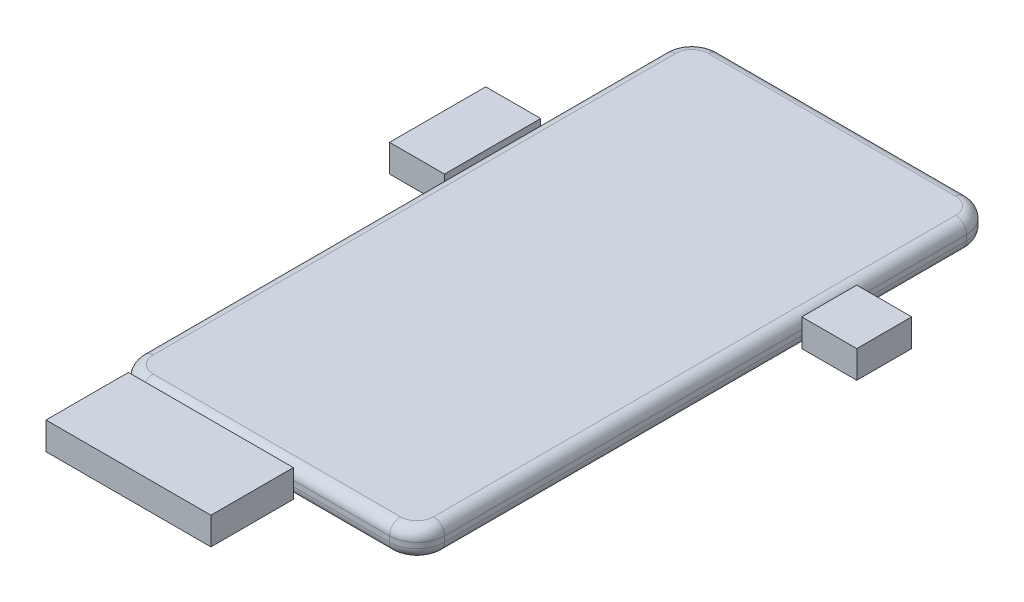
from build123d import *

# Parameters (mm, degrees)
SKETCH1_W           = 69.85
SKETCH1_H           = 133.35
BOSS_EXTRUDE1_DEPTH = 6.35
FILLET2_R           = 6.35
FILLET3_R           = 2.54
SKETCH2_W           = 12.7
SKETCH2_H           = 12.7
BUTTONS_DEPTH       = 6.35
SKETCH2_H_2         = 22.225
BUTTONS_2_DEPTH     = 6.35
SKETCH3_W           = 44.45
SKETCH3_H           = 19.05
CAMERA_DEPTH        = 6.35
SKETCH4_W           = 38.1
SKETCH4_H           = 19.05
USB_DEPTH           = 6.35


with BuildPart() as part:
    # Sketch1 → Boss-Extrude1 (new body)
    with BuildSketch(Plane(origin=(0, 0, 0), x_dir=(1, 0, 0), z_dir=(0, 1, 0))):
        with Locations((34.925, 66.675)):
            Rectangle(SKETCH1_W, SKETCH1_H)
    extrude(amount=BOSS_EXTRUDE1_DEPTH)

    # Fillet2
    fillet2_edges = [part.edges().sort_by_distance(p)[0] for p in [
        (0, 3.175, -133.35),
        (69.85, 3.175, -133.35),
        (69.85, 3.175, 0),
        (0, 3.175, 0),
    ]]
    fillet(fillet2_edges, radius=FILLET2_R)

    # Fillet3
    fillet3_edges = [part.edges().sort_by_distance(p)[0] for p in [
        (0, 0, -66.675),
        (0, 6.35, -66.675),
        (34.925, 0, -133.35),
        (69.85, 0, -66.675),
        (34.925, 0, 0),
        (67.990128061, 0, -1.859871939),
        (1.859871939, 0, -1.859871939),
        (67.990128061, 0, -131.490128061),
        (1.859871939, 0, -131.490128061),
        (34.925, 6.35, -133.35),
        (34.925, 6.35, 0),
        (69.85, 6.35, -66.675),
        (67.990128061, 6.35, -1.859871939),
        (1.859871939, 6.35, -1.859871939),
        (67.990128061, 6.35, -131.490128061),
        (1.859871939, 6.35, -131.490128061),
    ]]
    fillet(fillet3_edges, radius=FILLET3_R)


with BuildPart() as body_2:
    # Sketch2 → buttons (new body)
    with BuildSketch(Plane(origin=(0, 0, 0), x_dir=(1, 0, 0), z_dir=(0, 1, 0))):
        with Locations((76.2, 95.25)):
            Rectangle(SKETCH2_W, SKETCH2_H)
    extrude(amount=BUTTONS_DEPTH)


with BuildPart() as body_3:
    # Sketch2 → buttons 2 (new body)
    with BuildSketch(Plane(origin=(0, 0, 0), x_dir=(1, 0, 0), z_dir=(0, 1, 0))):
        with Locations((-6.35, 87.3125)):
            Rectangle(SKETCH2_W, SKETCH2_H_2)
    extrude(amount=BUTTONS_2_DEPTH)


with BuildPart() as body_4:
    # Sketch3 → camera (new body)
    with BuildSketch(Plane.XZ):
        with Locations((34.925, -117.475)):
            Rectangle(SKETCH3_W, SKETCH3_H)
    extrude(amount=CAMERA_DEPTH)


with BuildPart() as body_5:
    # Sketch4 → USB (new body)
    with BuildSketch(Plane(origin=(0, 0, 0), x_dir=(1, 0, 0), z_dir=(0, 1, 0))):
        with Locations((22.225, -9.525)):
            Rectangle(SKETCH4_W, SKETCH4_H)
    extrude(amount=USB_DEPTH)


solid = Compound([part.part, body_2.part, body_3.part, body_4.part, body_5.part])
